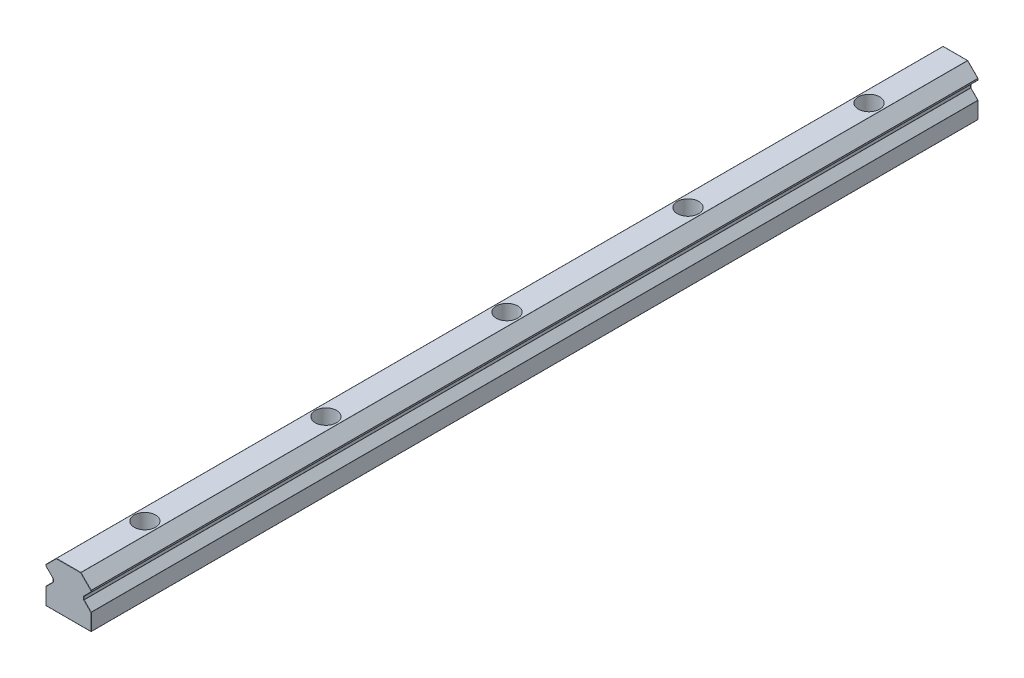
from build123d import *

# Parameters (mm, degrees)
EXTRUDE_1_DEPTH        = 294
FILLET_1_R             = 0.1
SKETCH_2_R             = 3.55
CUT_EXTRUDE_1_DEPTH    = 6
PATTERN_LINEAR_1_COUNT = 20
PATTERN_LINEAR_1_PITCH = 60
SKETCH_3_R             = 2.25
CUT_EXTRUDE_3_DEPTH    = 20
PATTERN_LINEAR_2_COUNT = 20
PATTERN_LINEAR_2_PITCH = 60


with BuildPart() as part:
    # Эскиз1 → Бобышка-Вытянуть1 (new body)
    with BuildSketch(Plane.XY):
        Polygon((-8.077815221, -6.752458719), (6.922184779, -6.752458719), (6.922184779, -1.152458719), (4.538392714, 1.231333345), (4.538392714, 2.234063435), (6.922184779, 4.617855499), (6.922184779, 5.117855499), (3.492498997, 8.547541281), (-4.64812944, 8.547541281), (-8.077815221, 5.117855499), (-8.077815221, 4.617855499), (-5.694023157, 2.234063435), (-5.694023157, 1.231333345), (-8.077815221, -1.152458719), align=None)
    extrude(amount=EXTRUDE_1_DEPTH)

    # Скругление1
    fillet_1_edges = [part.edges().sort_by_distance(p)[0] for p in [
        (6.922184779, -3.952458719, 294),
        (-6.885919189, 0.039437313, 0),
        (-5.694023157, 1.73269839, 0),
        (5.730288746, 0.039437313, 294),
        (-6.885919189, 3.425959467, 0),
        (-8.077815221, 4.867855499, 0),
        (-6.362972331, 6.83269839, 0),
        (-0.577815221, 8.547541281, 0),
        (5.207341888, 6.83269839, 0),
        (6.922184779, 4.867855499, 0),
        (5.730288746, 3.425959467, 0),
        (4.538392714, 1.73269839, 294),
        (4.538392714, 1.73269839, 0),
        (5.730288746, 0.039437313, 0),
        (6.922184779, -3.952458719, 0),
        (-0.577815221, -6.752458719, 0),
        (-8.077815221, -3.952458719, 0),
        (5.730288746, 3.425959467, 294),
        (6.922184779, 4.867855499, 294),
        (-8.077815221, -1.152458719, 147),
        (-5.694023157, 1.231333345, 147),
        (-5.694023157, 2.234063435, 147),
        (-8.077815221, 4.617855499, 147),
        (-8.077815221, 5.117855499, 147),
        (-4.64812944, 8.547541281, 147),
        (3.492498997, 8.547541281, 147),
        (6.922184779, 5.117855499, 147),
        (6.922184779, 4.617855499, 147),
        (4.538392714, 2.234063435, 147),
        (4.538392714, 1.231333345, 147),
        (6.922184779, -1.152458719, 147),
        (6.922184779, -6.752458719, 147),
        (-8.077815221, -6.752458719, 147),
        (5.207341888, 6.83269839, 294),
        (-0.577815221, 8.547541281, 294),
        (-6.362972331, 6.83269839, 294),
        (-8.077815221, 4.867855499, 294),
        (-6.885919189, 3.425959467, 294),
        (-8.077815221, -3.952458719, 294),
        (-5.694023157, 1.73269839, 294),
        (-6.885919189, 0.039437313, 294),
        (-0.577815221, -6.752458719, 294),
    ]]
    fillet(fillet_1_edges, radius=FILLET_1_R)

    # Эскиз2 → Вырез-Вытянуть1 (cut)
    with BuildSketch(Plane(origin=(0, 8.547541281, 0), x_dir=(1, 0, 0), z_dir=(0, 1, 0))):
        with Locations(Location((-0.647418762, -28.6, 0), (0, 0, 270))):
            Circle(SKETCH_2_R)
    cut_extrude_1 = extrude(amount=-CUT_EXTRUDE_1_DEPTH, mode=Mode.SUBTRACT)

    # Линейный массив1: Вырез-Вытянуть1 ×20
    with Locations(*[(0, 0, i * PATTERN_LINEAR_1_PITCH) for i in range(1, PATTERN_LINEAR_1_COUNT)]):
        add(cut_extrude_1, mode=Mode.SUBTRACT)

    # Эскиз3 → Вырез-Вытянуть3 (cut)
    with BuildSketch(Plane(origin=(0, 2.547541281, 0), x_dir=(1, 0, 0), z_dir=(0, 1, 0))):
        with Locations(Location((-0.647418762, -28.6, 0), (0, 0, 270))):
            Circle(SKETCH_3_R)
    cut_extrude_3 = extrude(amount=-CUT_EXTRUDE_3_DEPTH, mode=Mode.SUBTRACT)

    # Линейный массив2: Вырез-Вытянуть3 ×20
    with Locations(*[(0, 0, i * PATTERN_LINEAR_2_PITCH) for i in range(1, PATTERN_LINEAR_2_COUNT)]):
        add(cut_extrude_3, mode=Mode.SUBTRACT)


solid = part.part
